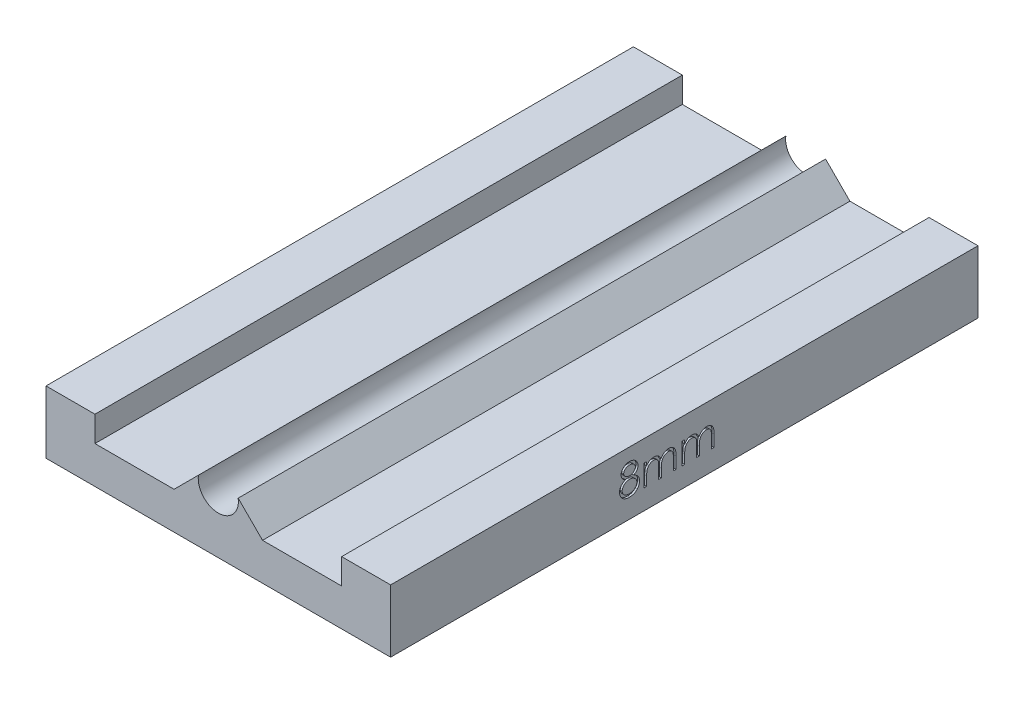
from build123d import *

# Parameters (mm, degrees)
BOSS_EXTRUDE1_DEPTH = 120
CUT_EXTRUDE1_DEPTH  = 0.4


with BuildPart() as part:
    # Sketch1 → Boss-Extrude1 (new body)
    with BuildSketch(Plane.XY):
        with BuildLine():
            ThreePointArc((4.1, 0), (-0.288474993, -4.089838894), (-4.059405941, 0.575520121))
            Line((-4.059405941, 0.575520121), (-9.036650456, -4.401724394))
            Line((-9.036650456, -4.401724394), (-25.2, -4.401724394))
            Line((-25.2, -4.401724394), (-25.2, 0.798275606))
            Line((-25.2, 0.798275606), (-35.2, 0.798275606))
            Line((-35.2, 0.798275606), (-35.2, -12))
            Line((-35.2, -12), (35.2, -12))
            Line((35.2, -12), (35.2, 0.798275606))
            Line((35.2, 0.798275606), (25.2, 0.798275606))
            Line((25.2, 0.798275606), (25.2, -4.401724394))
            Line((25.2, -4.401724394), (9.036650456, -4.401724394))
            Line((9.036650456, -4.401724394), (4.059405941, 0.575520121))
            ThreePointArc((4.059405941, 0.575520121), (4.089838894, 0.288474993), (4.1, 0))
        make_face()
    extrude(amount=BOSS_EXTRUDE1_DEPTH)

    # Sketch2 → Cut-Extrude1 (cut)
    # profile 1 of 3: a face of its own
    with BuildSketch(Plane(origin=(35.2, 0, 0), x_dir=(0, 0, -1), z_dir=(1, 0, 0))):
        with BuildLine():
            add(Edge.make_bspline(
                [(-70.312880632, -4.58805363), (-70.263768837, -4.613661555), (-70.167984435, -4.66360556), (-70.031566364, -4.744024122), (-69.906894933, -4.828780061), (-69.790511113, -4.913870106), (-69.684459654, -5.002552937), (-69.589926375, -5.095181205), (-69.504576169, -5.189442825), (-69.430130254, -5.28693398), (-69.364649962, -5.387395664), (-69.308057731, -5.491091561), (-69.259685383, -5.597794419), (-69.221348917, -5.708668984), (-69.189768702, -5.822086576), (-69.168039094, -5.939511687), (-69.156352949, -6.060170558), (-69.154143554, -6.141716218), (-69.153024863, -6.183005554)],
                knots=[0, 0, 0, 0, 1.272397273, 2.481599622, 3.635517121, 4.734568067, 5.792894095, 6.808321871, 7.773003508, 8.711915296, 9.623354172, 10.525449501, 11.423591555, 12.311487226, 13.218079475, 14.126165749, 15.051214107, 16, 16, 16, 16], degree=3))
            add(Edge.make_bspline(
                [(-69.153024863, -6.183005554), (-69.154347298, -6.240773095), (-69.156964894, -6.355116735), (-69.179764866, -6.523881498), (-69.213901401, -6.68778741), (-69.263751993, -6.846798537), (-69.32840352, -7.000037463), (-69.408078096, -7.14763536), (-69.498268734, -7.292011319), (-69.570701144, -7.380844579), (-69.607351786, -7.425794015)],
                knots=[0, 0, 0, 0, 1.025265484, 2.029385089, 3.018602448, 3.995076438, 4.983346944, 5.966715145, 6.97116228, 8, 8, 8, 8], degree=3))
            add(Edge.make_bspline(
                [(-69.607351786, -7.425794015), (-69.655071456, -7.478240485), (-69.749921111, -7.58248533), (-69.91240613, -7.717829575), (-70.09072936, -7.831571394), (-70.284200787, -7.92426607), (-70.492303247, -7.996413257), (-70.714992397, -8.048257573), (-70.952702374, -8.077953166), (-71.116083181, -8.08224572), (-71.199899863, -8.084447861)],
                knots=[0, 0, 0, 0, 0.954267603, 1.896743057, 2.838368354, 3.796610408, 4.779680527, 5.799409237, 6.871065594, 8, 8, 8, 8], degree=3))
            add(Edge.make_bspline(
                [(-71.199899863, -8.084447861), (-71.280494243, -8.082472185), (-71.437322722, -8.078627719), (-71.665593369, -8.052580122), (-71.878375774, -8.006932351), (-72.076907148, -7.944455877), (-72.259990623, -7.8631812), (-72.42710451, -7.762023928), (-72.580659891, -7.645055742), (-72.715996703, -7.508917322), (-72.836148321, -7.363103826), (-72.941693555, -7.212672495), (-73.029420547, -7.057609597), (-73.103695568, -6.900227253), (-73.160555035, -6.73831956), (-73.199935967, -6.572719538), (-73.22494622, -6.403716436), (-73.228273879, -6.289662173), (-73.22994794, -6.2322844)],
                knots=[0, 0, 0, 0, 1.256902934, 2.445805442, 3.576955095, 4.645999104, 5.686449165, 6.692658513, 7.68621702, 8.689161843, 9.678783111, 10.630372946, 11.551080876, 12.453998257, 13.34127905, 14.221779781, 15.105423033, 16, 16, 16, 16], degree=3))
            add(Edge.make_bspline(
                [(-73.22994794, -6.2322844), (-73.228957287, -6.190182928), (-73.226999406, -6.106975559), (-73.213448238, -5.984045282), (-73.191662304, -5.864394765), (-73.162074664, -5.747582061), (-73.121975761, -5.634457594), (-73.073560676, -5.524485354), (-73.0171059, -5.417541184), (-72.951823903, -5.313040245), (-72.875877576, -5.212446796), (-72.789882748, -5.114053662), (-72.692120687, -5.019387604), (-72.583678986, -4.927292018), (-72.465796919, -4.836133206), (-72.335412581, -4.750837671), (-72.195982408, -4.665366875), (-72.096887426, -4.614266888), (-72.046053709, -4.58805363)],
                knots=[0, 0, 0, 0, 0.941657376, 1.861047343, 2.762797495, 3.66048619, 4.553285746, 5.444104102, 6.34607688, 7.256116206, 8.197091036, 9.162375105, 10.176350973, 11.237807142, 12.343728897, 13.50695164, 14.721116704, 16, 16, 16, 16], degree=3))
            add(Edge.make_bspline(
                [(-72.046053709, -4.58805363), (-72.115638923, -4.550108313), (-72.250375373, -4.476635557), (-72.42878013, -4.341641032), (-72.582021198, -4.19543335), (-72.705886429, -4.03492513), (-72.803381677, -3.865130488), (-72.870270713, -3.68711177), (-72.915521828, -3.504169861), (-72.920004389, -3.37918781), (-72.922255632, -3.316419015)],
                knots=[0, 0, 0, 0, 1.166880483, 2.259407225, 3.286803203, 4.280235371, 5.237608625, 6.161067461, 7.076446754, 8, 8, 8, 8], degree=3))
            add(Edge.make_bspline(
                [(-72.922255632, -3.316419015), (-72.919452048, -3.252480344), (-72.913816355, -3.123952463), (-72.868244948, -2.93262768), (-72.793981977, -2.744713569), (-72.692974553, -2.561120918), (-72.567167897, -2.388063407), (-72.416230961, -2.232850357), (-72.243768167, -2.096887815), (-72.050640395, -1.982757233), (-71.842806848, -1.889870961), (-71.62352275, -1.825793665), (-71.396608762, -1.783903179), (-71.242155528, -1.779160343), (-71.163842171, -1.776755554)],
                knots=[0, 0, 0, 0, 0.888701115, 1.786444228, 2.72001202, 3.692817113, 4.693886446, 5.687152267, 6.695133018, 7.739871481, 8.800368666, 9.853104506, 10.91144658, 12, 12, 12, 12], degree=3))
            add(Edge.make_bspline(
                [(-71.163842171, -1.776755554), (-71.087549916, -1.779234999), (-70.937110282, -1.784124183), (-70.715976635, -1.824901688), (-70.504391131, -1.893009436), (-70.303083418, -1.985404676), (-70.11565736, -2.09921086), (-69.950053401, -2.23704093), (-69.803768975, -2.391569303), (-69.682767156, -2.564574337), (-69.583059346, -2.747461526), (-69.51362923, -2.938814419), (-69.469140131, -3.13449852), (-69.46352865, -3.266906527), (-69.460717171, -3.333245938)],
                knots=[0, 0, 0, 0, 1.072916533, 2.115669174, 3.151510826, 4.193348718, 5.225979165, 6.227137561, 7.216255879, 8.211077061, 9.189680878, 10.138522389, 11.067357538, 12, 12, 12, 12], degree=3))
            add(Edge.make_bspline(
                [(-69.460717171, -3.333245938), (-69.463176417, -3.398348791), (-69.468006238, -3.526207092), (-69.508634706, -3.712595413), (-69.577057529, -3.88714748), (-69.670476094, -4.051843969), (-69.792234073, -4.203697965), (-69.940706187, -4.344640485), (-70.114708721, -4.475829334), (-70.245441669, -4.549863101), (-70.312880632, -4.58805363)],
                knots=[0, 0, 0, 0, 0.975232327, 1.915300861, 2.843280834, 3.77672583, 4.742871857, 5.749627742, 6.839139064, 8, 8, 8, 8], degree=3))
        make_face()
        with BuildLine():
            add(Edge.make_bspline(
                [(-71.193890247, -2.392140169), (-71.235977343, -2.393256924), (-71.318318105, -2.395441786), (-71.43905297, -2.406856592), (-71.553862742, -2.429062107), (-71.663946972, -2.458614183), (-71.767796365, -2.498536449), (-71.866821315, -2.545499322), (-71.959336498, -2.602595434), (-72.046458731, -2.666643202), (-72.124888631, -2.737088184), (-72.194496433, -2.81048313), (-72.252316058, -2.888269517), (-72.301415103, -2.968512419), (-72.337040561, -3.053593407), (-72.363722225, -3.140903995), (-72.381758896, -3.231547511), (-72.383110422, -3.293495814), (-72.383794094, -3.324832477)],
                knots=[0, 0, 0, 0, 1.203892937, 2.355340988, 3.463153438, 4.544400666, 5.610487187, 6.640501085, 7.674077295, 8.714426146, 9.728707835, 10.68524104, 11.601827946, 12.495867327, 13.368432065, 14.231010473, 15.105153427, 16, 16, 16, 16], degree=3))
            add(Edge.make_bspline(
                [(-72.383794094, -3.324832477), (-72.38261575, -3.356170493), (-72.380287175, -3.418098915), (-72.362278384, -3.509548971), (-72.335438061, -3.599414634), (-72.293179785, -3.685559053), (-72.242494599, -3.770970526), (-72.179937783, -3.853514388), (-72.105385164, -3.933477905), (-72.021338123, -4.010180947), (-71.929775487, -4.082007398), (-71.83277427, -4.144361423), (-71.731551885, -4.196534184), (-71.627148337, -4.239956021), (-71.51849957, -4.273710199), (-71.40627133, -4.29765645), (-71.290444755, -4.312539873), (-71.211963759, -4.314317624), (-71.172255632, -4.315217092)],
                knots=[0, 0, 0, 0, 0.873023192, 1.725219244, 2.590779336, 3.480155217, 4.391973325, 5.357036234, 6.360879153, 7.436073238, 8.526419356, 9.601555421, 10.645666583, 11.697338044, 12.750135903, 13.812665442, 14.89329948, 16, 16, 16, 16], degree=3))
            add(Edge.make_bspline(
                [(-71.172255632, -4.315217092), (-71.121255454, -4.313720748), (-71.019758824, -4.31074284), (-70.870137113, -4.283055114), (-70.724658294, -4.239502112), (-70.584877315, -4.179913598), (-70.454412311, -4.105122982), (-70.338115052, -4.015580665), (-70.236977521, -3.913354212), (-70.152050761, -3.800035065), (-70.08620531, -3.679432343), (-70.034945068, -3.558403269), (-70.005011556, -3.435656588), (-70.001107155, -3.353427507), (-69.999178709, -3.312813246)],
                knots=[0, 0, 0, 0, 1.076279235, 2.141928126, 3.20205304, 4.278698113, 5.344010996, 6.36967002, 7.368914609, 8.37248503, 9.349703398, 10.264243087, 11.142681841, 12, 12, 12, 12], degree=3))
            add(Edge.make_bspline(
                [(-69.999178709, -3.312813246), (-70.000090533, -3.284308041), (-70.001900374, -3.227729296), (-70.016814756, -3.144177813), (-70.041459041, -3.062527098), (-70.074824321, -2.982102634), (-70.118726826, -2.904032808), (-70.170779719, -2.827090371), (-70.234010293, -2.753006205), (-70.304975607, -2.680053836), (-70.385453451, -2.612538367), (-70.475288729, -2.553164578), (-70.574020873, -2.502743395), (-70.681652215, -2.461791244), (-70.797786371, -2.43103293), (-70.921888441, -2.407999191), (-71.054993208, -2.395016715), (-71.146587067, -2.393119814), (-71.193890247, -2.392140169)],
                knots=[0, 0, 0, 0, 0.814439003, 1.616544685, 2.417341072, 3.248991801, 4.09997495, 4.973547432, 5.9003056, 6.880240646, 7.880314356, 8.896779544, 9.951930927, 11.043077905, 12.18215768, 13.381699519, 14.647792085, 16, 16, 16, 16], degree=3))
        make_face(mode=Mode.SUBTRACT)
        with BuildLine():
            add(Edge.make_bspline(
                [(-71.159034478, -4.930601707), (-71.212392968, -4.931550807), (-71.317069305, -4.933412709), (-71.470424038, -4.954137566), (-71.617600894, -4.982987955), (-71.758103642, -5.026755106), (-71.891872951, -5.083663375), (-72.019632978, -5.152122587), (-72.140406343, -5.233046203), (-72.252525302, -5.325406116), (-72.354908153, -5.424936608), (-72.44473381, -5.530300268), (-72.521015274, -5.639538896), (-72.582443704, -5.754039861), (-72.632863816, -5.871378622), (-72.66597332, -5.994477357), (-72.687199111, -6.120969551), (-72.690049336, -6.206958291), (-72.691486401, -6.250313246)],
                knots=[0, 0, 0, 0, 1.140299081, 2.23698856, 3.303958914, 4.344563908, 5.37730929, 6.408454204, 7.439741482, 8.480804886, 9.510774543, 10.48932336, 11.43758569, 12.353841022, 13.263987381, 14.161954604, 15.073269652, 16, 16, 16, 16], degree=3))
            add(Edge.make_bspline(
                [(-72.691486401, -6.250313246), (-72.689149386, -6.304194799), (-72.684512803, -6.411094542), (-72.647729994, -6.569088379), (-72.588697647, -6.722038758), (-72.506368705, -6.868699249), (-72.404424295, -7.005756574), (-72.279064636, -7.125223046), (-72.138080343, -7.231374152), (-71.976701164, -7.317226495), (-71.800423794, -7.385789104), (-71.609295116, -7.433027897), (-71.406058112, -7.464298954), (-71.265727383, -7.467450122), (-71.193890247, -7.469063246)],
                knots=[0, 0, 0, 0, 0.898778495, 1.783155532, 2.693654817, 3.627872908, 4.583023416, 5.533784346, 6.509005473, 7.520592997, 8.575161974, 9.658835044, 10.801527049, 12, 12, 12, 12], degree=3))
            add(Edge.make_bspline(
                [(-71.193890247, -7.469063246), (-71.13774676, -7.467985289), (-71.028361241, -7.465885082), (-70.868785329, -7.447346292), (-70.718194674, -7.417946935), (-70.576881305, -7.375186571), (-70.443263294, -7.322986611), (-70.319606116, -7.255834471), (-70.202728641, -7.179459061), (-70.098390145, -7.088845078), (-70.003361787, -6.992023087), (-69.920504714, -6.88952587), (-69.848577484, -6.784139072), (-69.792124417, -6.673481098), (-69.746993696, -6.559674959), (-69.714553316, -6.441671225), (-69.694536947, -6.319107969), (-69.692512555, -6.235966704), (-69.691486401, -6.193822861)],
                knots=[0, 0, 0, 0, 1.224942928, 2.386581632, 3.501229538, 4.569074225, 5.605009692, 6.626002462, 7.634866581, 8.645888296, 9.63523824, 10.59253846, 11.518950513, 12.414518923, 13.29783783, 14.186679152, 15.080837789, 16, 16, 16, 16], degree=3))
            add(Edge.make_bspline(
                [(-69.691486401, -6.193822861), (-69.693039284, -6.152890277), (-69.696101299, -6.072178372), (-69.715535627, -5.952578612), (-69.749677131, -5.837030931), (-69.796524097, -5.724145206), (-69.858891461, -5.616208719), (-69.93233981, -5.510409569), (-70.020958299, -5.409684235), (-70.121094178, -5.313250356), (-70.230223825, -5.224080522), (-70.346224645, -5.145198627), (-70.468203723, -5.078766428), (-70.595902941, -5.02473815), (-70.729038751, -4.982245345), (-70.867513229, -4.952560782), (-71.0114885, -4.933875748), (-71.10929685, -4.931705384), (-71.159034478, -4.930601707)],
                knots=[0, 0, 0, 0, 0.917430815, 1.809013306, 2.70690318, 3.612392954, 4.541220862, 5.495268465, 6.494511384, 7.542276156, 8.608045339, 9.649016899, 10.681629292, 11.715607085, 12.752076957, 13.808767841, 14.885711793, 16, 16, 16, 16], degree=3))
        make_face(mode=Mode.SUBTRACT)
    # profile 2 of 3: a face of its own
    with BuildSketch(Plane(origin=(35.2, 0, 0), x_dir=(0, 0, -1), z_dir=(1, 0, 0))):
        with BuildLine():
            Line((-68.22994794, -3.545986323), (-67.691486401, -3.545986323))
            Line((-67.691486401, -3.545986323), (-67.691486401, -4.308005554))
            add(Edge.make_bspline(
                [(-67.691486401, -4.308005554), (-67.64299963, -4.241341093), (-67.550094328, -4.113605597), (-67.397753209, -3.945279395), (-67.245565588, -3.80243113), (-67.135965505, -3.72744335), (-67.083313324, -3.691419015)],
                knots=[0, 0, 0, 0, 1.134379233, 2.173579362, 3.122582517, 4, 4, 4, 4], degree=3))
            add(Edge.make_bspline(
                [(-67.083313324, -3.691419015), (-67.011545332, -3.657124103), (-66.869263218, -3.589133452), (-66.643973118, -3.520161636), (-66.413445113, -3.477775748), (-66.25777389, -3.471979108), (-66.179467171, -3.469063246)],
                knots=[0, 0, 0, 0, 1.014936303, 2.012140481, 3.000054389, 4, 4, 4, 4], degree=3))
            add(Edge.make_bspline(
                [(-66.179467171, -3.469063246), (-66.126507748, -3.470855173), (-66.021703898, -3.4744013), (-65.866416886, -3.497475646), (-65.715802123, -3.537360514), (-65.570749502, -3.592915927), (-65.43408548, -3.660195961), (-65.308789712, -3.739138318), (-65.19629107, -3.827761876), (-65.09664641, -3.930068618), (-65.007042367, -4.048931358), (-64.924621487, -4.187555785), (-64.84846398, -4.349054633), (-64.806256022, -4.466254417), (-64.784034478, -4.527957477)],
                knots=[0, 0, 0, 0, 1.009824226, 1.998387844, 2.986035974, 3.974953746, 4.955485308, 5.885931332, 6.793869504, 7.679848016, 8.601185859, 9.625726857, 10.749998409, 12, 12, 12, 12], degree=3))
            add(Edge.make_bspline(
                [(-64.784034478, -4.527957477), (-64.760529476, -4.485572758), (-64.714274932, -4.402165584), (-64.636608126, -4.284122848), (-64.55523476, -4.173711205), (-64.469461344, -4.070843049), (-64.379590623, -3.976026368), (-64.285199652, -3.88894768), (-64.186825741, -3.809233028), (-64.050039044, -3.716107612), (-63.872074574, -3.617191301), (-63.647694949, -3.531428254), (-63.414294654, -3.478429177), (-63.255864314, -3.472205852), (-63.175861401, -3.469063246)],
                knots=[0, 0, 0, 0, 0.86119277, 1.694706429, 2.50939023, 3.298075842, 4.073795165, 4.829715201, 5.57930267, 6.321991688, 7.768977793, 9.186738141, 10.579381044, 12, 12, 12, 12], degree=3))
            add(Edge.make_bspline(
                [(-63.175861401, -3.469063246), (-63.102350322, -3.471835624), (-62.958482003, -3.477261439), (-62.749035262, -3.519867393), (-62.553706453, -3.593029074), (-62.372888608, -3.692858165), (-62.209757499, -3.818308193), (-62.067958112, -3.967569058), (-61.948351775, -4.139584983), (-61.870216964, -4.301399821), (-61.817219368, -4.444260391), (-61.784542966, -4.565985462), (-61.755674918, -4.699959553), (-61.731707069, -4.846342858), (-61.714189551, -5.005652473), (-61.701211181, -5.177627688), (-61.692427055, -5.362402166), (-61.69180636, -5.48988588), (-61.691486401, -5.555601707)],
                knots=[0, 0, 0, 0, 1.209669288, 2.367440248, 3.500751976, 4.631527125, 5.755587489, 6.87532382, 8.007944318, 9.190864318, 9.82315674, 10.514484317, 11.263564316, 12.079023757, 12.955305781, 13.901327259, 14.918167583, 16, 16, 16, 16], degree=3))
            Line((-61.691486401, -5.555601707), (-61.691486401, -7.930601707))
            Line((-61.691486401, -7.930601707), (-62.22994794, -7.930601707))
            Line((-62.22994794, -7.930601707), (-62.22994794, -5.553197861))
            add(Edge.make_bspline(
                [(-62.22994794, -5.553197861), (-62.230081453, -5.497105449), (-62.230338046, -5.389304363), (-62.234955701, -5.234585875), (-62.243656239, -5.093554405), (-62.253829905, -4.966402254), (-62.26796215, -4.852832903), (-62.286212319, -4.753074471), (-62.305545484, -4.666342223), (-62.337664326, -4.570194713), (-62.389003569, -4.464131495), (-62.467204963, -4.349748222), (-62.565725145, -4.250181136), (-62.679485414, -4.163749736), (-62.808997033, -4.093474922), (-62.951736559, -4.043287477), (-63.10681779, -4.012219685), (-63.214171142, -4.009123659), (-63.269611401, -4.007524784)],
                knots=[0, 0, 0, 0, 1.253487763, 2.409012846, 3.458416907, 4.410876679, 5.259312806, 6.014470957, 6.676830364, 7.243083969, 8.276244668, 9.299465089, 10.325150304, 11.392391894, 12.482080715, 13.603491619, 14.762376348, 16, 16, 16, 16], degree=3))
            add(Edge.make_bspline(
                [(-63.269611401, -4.007524784), (-63.337617037, -4.009952483), (-63.472022028, -4.014750538), (-63.66821429, -4.06373432), (-63.856736033, -4.137586178), (-64.031961975, -4.244613248), (-64.193152473, -4.372856157), (-64.331837464, -4.525341178), (-64.446406925, -4.697849624), (-64.523985169, -4.857529686), (-64.5729954, -5.000963018), (-64.605355827, -5.126272798), (-64.630527355, -5.268698343), (-64.654133977, -5.427282613), (-64.66954151, -5.603117208), (-64.683544434, -5.795388753), (-64.690094485, -6.00467554), (-64.6910107, -6.149749864), (-64.691486401, -6.225072861)],
                knots=[0, 0, 0, 0, 1.090531906, 2.155305635, 3.229839962, 4.33261226, 5.44038871, 6.529323825, 7.629011124, 8.757537029, 9.370236727, 10.061839251, 10.834451254, 11.692844982, 12.636905849, 13.66920014, 14.789842145, 16, 16, 16, 16], degree=3))
            Line((-64.691486401, -6.225072861), (-64.691486401, -7.930601707))
            Line((-64.691486401, -7.930601707), (-65.22994794, -7.930601707))
            Line((-65.22994794, -7.930601707), (-65.22994794, -5.7010344))
            add(Edge.make_bspline(
                [(-65.22994794, -5.7010344), (-65.230084107, -5.638131568), (-65.23034608, -5.517112841), (-65.234934052, -5.343569398), (-65.243653975, -5.185716117), (-65.253734915, -5.043736465), (-65.268238078, -4.917888473), (-65.284711956, -4.807497459), (-65.304166717, -4.712840172), (-65.336377948, -4.609017226), (-65.385602751, -4.494638501), (-65.464782628, -4.372682465), (-65.56353848, -4.265937155), (-65.679374268, -4.174807872), (-65.809669723, -4.099479618), (-65.953641267, -4.045205758), (-66.109992546, -4.013621261), (-66.217782899, -4.009595267), (-66.273217171, -4.007524784)],
                knots=[0, 0, 0, 0, 1.320475261, 2.540461679, 3.643808994, 4.639130445, 5.527981419, 6.302341397, 6.981980563, 7.553956391, 8.582137848, 9.585246428, 10.591171744, 11.620968678, 12.668337649, 13.738356861, 14.836885341, 16, 16, 16, 16], degree=3))
            add(Edge.make_bspline(
                [(-66.273217171, -4.007524784), (-66.338387819, -4.01014843), (-66.468270606, -4.015377263), (-66.659073983, -4.062441732), (-66.843335155, -4.136163003), (-67.018114638, -4.238436979), (-67.178698893, -4.365121114), (-67.319284494, -4.514118078), (-67.43747168, -4.683573564), (-67.515869077, -4.841569878), (-67.56643789, -4.981409778), (-67.600029892, -5.100297117), (-67.628897822, -5.232297542), (-67.650350431, -5.377818304), (-67.671059715, -5.535911608), (-67.68105453, -5.707365019), (-67.690777208, -5.892031455), (-67.691244205, -6.019527247), (-67.691486401, -6.085649784)],
                knots=[0, 0, 0, 0, 1.098833095, 2.189935336, 3.297829714, 4.440610912, 5.596351641, 6.740013378, 7.886572111, 9.072425424, 9.705826452, 10.395263256, 11.156850408, 11.985370555, 12.878090359, 13.847760091, 14.883794034, 16, 16, 16, 16], degree=3))
            Line((-67.691486401, -6.085649784), (-67.691486401, -7.930601707))
            Line((-67.691486401, -7.930601707), (-68.22994794, -7.930601707))
            Line((-68.22994794, -7.930601707), (-68.22994794, -3.545986323))
        make_face()
    # profile 3 of 3: a face of its own
    with BuildSketch(Plane(origin=(35.2, 0, 0), x_dir=(0, 0, -1), z_dir=(1, 0, 0))):
        with BuildLine():
            Line((-60.460717171, -3.545986323), (-59.922255632, -3.545986323))
            Line((-59.922255632, -3.545986323), (-59.922255632, -4.308005554))
            add(Edge.make_bspline(
                [(-59.922255632, -4.308005554), (-59.873768861, -4.241341093), (-59.780863559, -4.113605597), (-59.62852244, -3.945279395), (-59.476334819, -3.80243113), (-59.366734736, -3.72744335), (-59.314082555, -3.691419015)],
                knots=[0, 0, 0, 0, 1.134379233, 2.173579362, 3.122582517, 4, 4, 4, 4], degree=3))
            add(Edge.make_bspline(
                [(-59.314082555, -3.691419015), (-59.242314563, -3.657124103), (-59.100032449, -3.589133452), (-58.874742349, -3.520161636), (-58.644214344, -3.477775748), (-58.48854312, -3.471979108), (-58.410236401, -3.469063246)],
                knots=[0, 0, 0, 0, 1.014936303, 2.012140481, 3.000054389, 4, 4, 4, 4], degree=3))
            add(Edge.make_bspline(
                [(-58.410236401, -3.469063246), (-58.357276979, -3.470855173), (-58.252473129, -3.4744013), (-58.097186117, -3.497475646), (-57.946571354, -3.537360514), (-57.801518732, -3.592915927), (-57.664854711, -3.660195961), (-57.539558943, -3.739138318), (-57.427060301, -3.827761876), (-57.327415641, -3.930068618), (-57.237811598, -4.048931358), (-57.155390718, -4.187555785), (-57.079233211, -4.349054633), (-57.037025253, -4.466254417), (-57.014803709, -4.527957477)],
                knots=[0, 0, 0, 0, 1.009824226, 1.998387844, 2.986035974, 3.974953746, 4.955485308, 5.885931332, 6.793869504, 7.679848016, 8.601185859, 9.625726857, 10.749998409, 12, 12, 12, 12], degree=3))
            add(Edge.make_bspline(
                [(-57.014803709, -4.527957477), (-56.991298707, -4.485572758), (-56.945044163, -4.402165584), (-56.867377357, -4.284122848), (-56.786003991, -4.173711205), (-56.700230575, -4.070843049), (-56.610359854, -3.976026368), (-56.515968882, -3.88894768), (-56.417594971, -3.809233028), (-56.280808274, -3.716107612), (-56.102843804, -3.617191301), (-55.878464179, -3.531428254), (-55.645063885, -3.478429177), (-55.486633545, -3.472205852), (-55.406630632, -3.469063246)],
                knots=[0, 0, 0, 0, 0.86119277, 1.694706429, 2.50939023, 3.298075842, 4.073795165, 4.829715201, 5.57930267, 6.321991688, 7.768977793, 9.186738141, 10.579381044, 12, 12, 12, 12], degree=3))
            add(Edge.make_bspline(
                [(-55.406630632, -3.469063246), (-55.333119553, -3.471835624), (-55.189251234, -3.477261439), (-54.979804492, -3.519867393), (-54.784475683, -3.593029074), (-54.603657839, -3.692858165), (-54.44052673, -3.818308193), (-54.298727343, -3.967569058), (-54.179121005, -4.139584983), (-54.100986195, -4.301399821), (-54.047988599, -4.444260391), (-54.015312197, -4.565985462), (-53.986444148, -4.699959553), (-53.962476299, -4.846342858), (-53.944958781, -5.005652473), (-53.931980412, -5.177627688), (-53.923196286, -5.362402166), (-53.922575591, -5.48988588), (-53.922255632, -5.555601707)],
                knots=[0, 0, 0, 0, 1.209669288, 2.367440248, 3.500751976, 4.631527125, 5.755587489, 6.87532382, 8.007944318, 9.190864318, 9.82315674, 10.514484317, 11.263564316, 12.079023757, 12.955305781, 13.901327259, 14.918167583, 16, 16, 16, 16], degree=3))
            Line((-53.922255632, -5.555601707), (-53.922255632, -7.930601707))
            Line((-53.922255632, -7.930601707), (-54.460717171, -7.930601707))
            Line((-54.460717171, -7.930601707), (-54.460717171, -5.553197861))
            add(Edge.make_bspline(
                [(-54.460717171, -5.553197861), (-54.460850684, -5.497105449), (-54.461107277, -5.389304363), (-54.465724931, -5.234585875), (-54.47442547, -5.093554405), (-54.484599136, -4.966402254), (-54.498731381, -4.852832903), (-54.516981549, -4.753074471), (-54.536314715, -4.666342223), (-54.568433557, -4.570194713), (-54.6197728, -4.464131495), (-54.697974194, -4.349748222), (-54.796494376, -4.250181136), (-54.910254645, -4.163749736), (-55.039766264, -4.093474922), (-55.182505789, -4.043287477), (-55.337587021, -4.012219685), (-55.444940372, -4.009123659), (-55.500380632, -4.007524784)],
                knots=[0, 0, 0, 0, 1.253487763, 2.409012846, 3.458416907, 4.410876679, 5.259312806, 6.014470957, 6.676830364, 7.243083969, 8.276244668, 9.299465089, 10.325150304, 11.392391894, 12.482080715, 13.603491619, 14.762376348, 16, 16, 16, 16], degree=3))
            add(Edge.make_bspline(
                [(-55.500380632, -4.007524784), (-55.568386268, -4.009952483), (-55.702791259, -4.014750538), (-55.898983521, -4.06373432), (-56.087505264, -4.137586178), (-56.262731206, -4.244613248), (-56.423921704, -4.372856157), (-56.562606694, -4.525341178), (-56.677176156, -4.697849624), (-56.7547544, -4.857529686), (-56.803764631, -5.000963018), (-56.836125058, -5.126272798), (-56.861296586, -5.268698343), (-56.884903207, -5.427282613), (-56.900310741, -5.603117208), (-56.914313665, -5.795388753), (-56.920863716, -6.00467554), (-56.921779931, -6.149749864), (-56.922255632, -6.225072861)],
                knots=[0, 0, 0, 0, 1.090531906, 2.155305635, 3.229839962, 4.33261226, 5.44038871, 6.529323825, 7.629011124, 8.757537029, 9.370236727, 10.061839251, 10.834451254, 11.692844982, 12.636905849, 13.66920014, 14.789842145, 16, 16, 16, 16], degree=3))
            Line((-56.922255632, -6.225072861), (-56.922255632, -7.930601707))
            Line((-56.922255632, -7.930601707), (-57.460717171, -7.930601707))
            Line((-57.460717171, -7.930601707), (-57.460717171, -5.7010344))
            add(Edge.make_bspline(
                [(-57.460717171, -5.7010344), (-57.460853338, -5.638131568), (-57.46111531, -5.517112841), (-57.465703283, -5.343569398), (-57.474423206, -5.185716117), (-57.484504146, -5.043736465), (-57.499007309, -4.917888473), (-57.515481187, -4.807497459), (-57.534935948, -4.712840172), (-57.567147179, -4.609017226), (-57.616371981, -4.494638501), (-57.695551859, -4.372682465), (-57.794307711, -4.265937155), (-57.910143498, -4.174807872), (-58.040438953, -4.099479618), (-58.184410498, -4.045205758), (-58.340761777, -4.013621261), (-58.44855213, -4.009595267), (-58.503986401, -4.007524784)],
                knots=[0, 0, 0, 0, 1.320475261, 2.540461679, 3.643808994, 4.639130445, 5.527981419, 6.302341397, 6.981980563, 7.553956391, 8.582137848, 9.585246428, 10.591171744, 11.620968678, 12.668337649, 13.738356861, 14.836885341, 16, 16, 16, 16], degree=3))
            add(Edge.make_bspline(
                [(-58.503986401, -4.007524784), (-58.56915705, -4.01014843), (-58.699039837, -4.015377263), (-58.889843214, -4.062441732), (-59.074104386, -4.136163003), (-59.248883869, -4.238436979), (-59.409468123, -4.365121114), (-59.550053724, -4.514118078), (-59.668240911, -4.683573564), (-59.746638308, -4.841569878), (-59.797207121, -4.981409778), (-59.830799123, -5.100297117), (-59.859667053, -5.232297542), (-59.881119662, -5.377818304), (-59.901828946, -5.535911608), (-59.911823761, -5.707365019), (-59.921546439, -5.892031455), (-59.922013436, -6.019527247), (-59.922255632, -6.085649784)],
                knots=[0, 0, 0, 0, 1.098833095, 2.189935336, 3.297829714, 4.440610912, 5.596351641, 6.740013378, 7.886572111, 9.072425424, 9.705826452, 10.395263256, 11.156850408, 11.985370555, 12.878090359, 13.847760091, 14.883794034, 16, 16, 16, 16], degree=3))
            Line((-59.922255632, -6.085649784), (-59.922255632, -7.930601707))
            Line((-59.922255632, -7.930601707), (-60.460717171, -7.930601707))
            Line((-60.460717171, -7.930601707), (-60.460717171, -3.545986323))
        make_face()
    extrude(amount=-CUT_EXTRUDE1_DEPTH, mode=Mode.SUBTRACT)


solid = part.part
